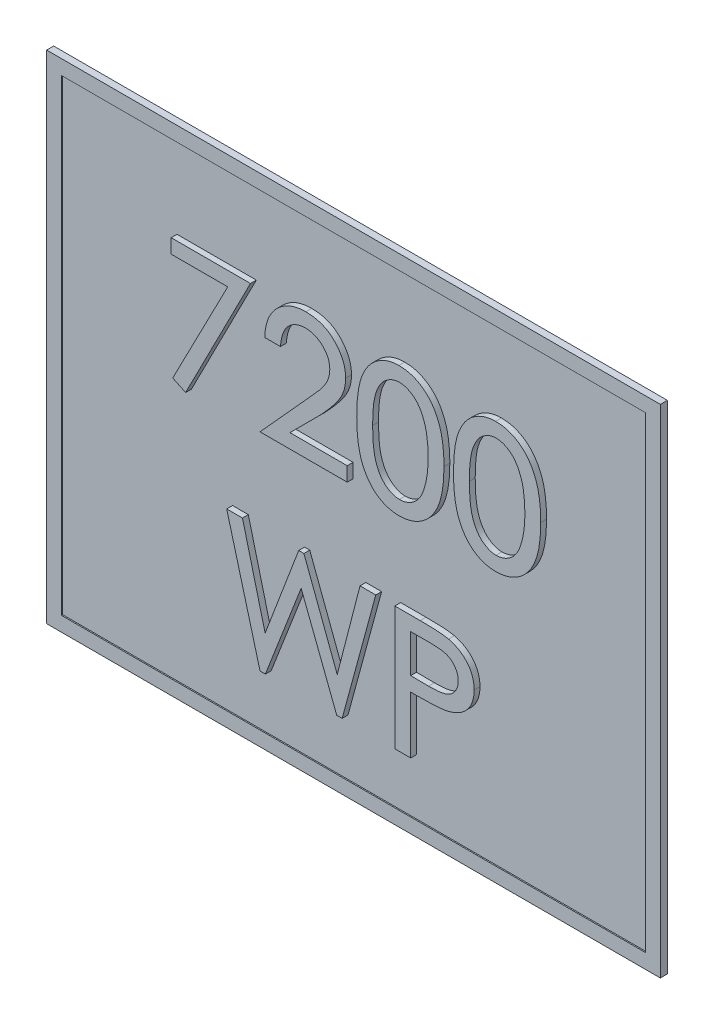
from build123d import *

# Parameters (mm, degrees)
SKETCH1_W           = 1000
SKETCH1_H           = 800
BOSS_EXTRUDE1_DEPTH = 10
BOSS_EXTRUDE2_DEPTH = 10
SKETCH3_W           = 1050
SKETCH3_H           = 850
SKETCH3_W_2         = 1000
SKETCH3_H_2         = 800
BOSS_EXTRUDE3_DEPTH = 12


with BuildPart() as part:
    # Sketch1 → Boss-Extrude1 (new body)
    with BuildSketch(Plane.XY):
        Rectangle(SKETCH1_W, SKETCH1_H)
    extrude(amount=BOSS_EXTRUDE1_DEPTH)

    # Sketch2 → Boss-Extrude2 (add)
    # profile 1 of 6: a face of its own
    with BuildSketch(Plane.XY.offset(10)):
        Polygon((-303.931623932, 261.496484556), (-168.247863248, 261.496484556), (-279.254139957, 44.402467462), (-301.302751068, 54.96036009), (-207.087339744, 237.073407633), (-303.931623932, 237.073407633), align=None)
    # profile 2 of 6: a face of its own
    with BuildSketch(Plane.XY.offset(10)):
        with BuildLine():
            Line((-116.984842415, 193.654604214), (-143.824786325, 193.654604214))
            add(Edge.make_bspline(
                [(-143.824786325, 193.654604214), (-143.69871103, 196.385712837), (-143.452125051, 201.727386582), (-142.357156167, 209.510802037), (-140.583384584, 216.844764853), (-138.344510397, 223.791447472), (-135.357914636, 230.264012655), (-131.91198054, 236.375293816), (-127.751946342, 241.997210511), (-123.050880422, 247.138656125), (-117.947707341, 251.809859568), (-112.461772398, 255.837749582), (-106.685804753, 259.270106613), (-100.618668625, 262.070932688), (-94.248482182, 264.239558842), (-87.593402868, 265.817613737), (-80.632200231, 266.76677627), (-75.886924768, 266.870998149), (-73.481236645, 266.923834983)],
                knots=[0, 0, 0, 0, 1.154964179, 2.258951466, 3.315045469, 4.34063582, 5.337653555, 6.322213479, 7.300594401, 8.285733883, 9.262436119, 10.219305053, 11.156568068, 12.097250375, 13.037875795, 13.995471444, 14.983774372, 16, 16, 16, 16], degree=3))
            add(Edge.make_bspline(
                [(-73.481236645, 266.923834983), (-70.962476003, 266.87231205), (-66.01997112, 266.771209807), (-58.822493601, 265.819825376), (-52.010739956, 264.285718668), (-45.582715712, 262.190680426), (-39.550132257, 259.393258731), (-33.90109372, 256.019876672), (-28.689901424, 251.965193259), (-23.878732846, 247.428255696), (-19.629226917, 242.43758701), (-15.791050294, 237.306586767), (-12.618425715, 231.931192437), (-9.960566041, 226.40955992), (-7.915301128, 220.696370897), (-6.470941449, 214.814875518), (-5.605168115, 208.761077237), (-5.486999268, 204.667561955), (-5.427350427, 202.601252184)],
                knots=[0, 0, 0, 0, 1.156722346, 2.269809107, 3.328396062, 4.361258308, 5.3694338, 6.377253737, 7.377324894, 8.397019439, 9.4098266, 10.385180797, 11.337325354, 12.27255833, 13.196816462, 14.119704983, 15.050871513, 16, 16, 16, 16], degree=3))
            add(Edge.make_bspline(
                [(-5.427350427, 202.601252184), (-5.535893279, 199.710823899), (-5.751492034, 193.969563868), (-7.411669208, 185.475699152), (-10.202621549, 177.255411689), (-13.426438497, 170.561941742), (-16.686940423, 165.151514586), (-19.679080716, 160.685692863), (-23.194071417, 155.856783925), (-27.307293295, 150.697112818), (-31.855187923, 145.088624288), (-37.018415546, 139.175999926), (-42.637166452, 132.839534507), (-46.644372193, 128.572851663), (-48.718950321, 126.36393915)],
                knots=[0, 0, 0, 0, 1.155755081, 2.295677249, 3.447123235, 4.6205014, 5.259503175, 5.973005395, 6.77029923, 7.648035671, 8.612336498, 9.658570495, 10.787814065, 12, 12, 12, 12], degree=3))
            Line((-48.718950321, 126.36393915), (-100.787593483, 74.252894812))
            Line((-100.787593483, 74.252894812), (-2.713675214, 74.252894812))
            Line((-2.713675214, 74.252894812), (-2.713675214, 49.829817889))
            Line((-2.713675214, 49.829817889), (-151.965811966, 49.829817889))
            Line((-151.965811966, 49.829817889), (-70.979567308, 139.253896415))
            add(Edge.make_bspline(
                [(-70.979567308, 139.253896415), (-69.050582316, 141.3111373), (-65.348824859, 145.259020161), (-60.131721813, 151.038086735), (-55.424726897, 156.380743605), (-51.202745329, 161.283133912), (-47.576333579, 165.811150982), (-44.447933934, 169.8981798), (-41.852960487, 173.56352009), (-39.1580682, 177.877930718), (-36.48770637, 183.049735857), (-34.216077865, 189.35861192), (-32.852989485, 195.8013429), (-32.660445325, 200.135682871), (-32.564102564, 202.304443958)],
                knots=[0, 0, 0, 0, 1.341560447, 2.574479018, 3.703506985, 4.728875774, 5.651874962, 6.462761537, 7.177175968, 7.787249671, 8.88179658, 9.938774664, 10.968630673, 12, 12, 12, 12], degree=3))
            add(Edge.make_bspline(
                [(-32.564102564, 202.304443958), (-32.587845467, 203.64986122), (-32.634825609, 206.312041762), (-33.275322502, 210.210485923), (-34.177577399, 213.99175983), (-35.573050162, 217.595071987), (-37.254338083, 221.091313674), (-39.357330145, 224.435288304), (-41.88264967, 227.595976904), (-44.691829996, 230.644492986), (-47.798857269, 233.396957731), (-51.080620577, 235.865516011), (-54.577477687, 237.870306464), (-58.193819275, 239.623530807), (-62.042061461, 240.866452169), (-66.027609869, 241.791871016), (-70.181759026, 242.432927327), (-73.012353713, 242.477843018), (-74.456463675, 242.50075806)],
                knots=[0, 0, 0, 0, 0.999432927, 1.977580462, 2.931018689, 3.885672852, 4.844657058, 5.812871023, 6.815890212, 7.849665183, 8.891901864, 9.898878619, 10.897592748, 11.885014695, 12.882178885, 13.896915602, 14.927050508, 16, 16, 16, 16], degree=3))
            add(Edge.make_bspline(
                [(-74.456463675, 242.50075806), (-75.829371732, 242.472599453), (-78.53024232, 242.41720408), (-82.507942794, 241.845652096), (-86.326042774, 240.91505308), (-89.997422385, 239.624227355), (-93.548672785, 238.031722057), (-96.892959958, 235.968634539), (-100.084945243, 233.568628087), (-103.166827456, 230.874982125), (-105.971695686, 227.714799122), (-108.480442004, 224.125527955), (-110.695764007, 220.10325767), (-112.589320132, 215.655024731), (-114.158602617, 210.769159163), (-115.417475405, 205.45160196), (-116.390705744, 199.700038973), (-116.783133173, 195.707027702), (-116.984842415, 193.654604214)],
                knots=[0, 0, 0, 0, 0.911540883, 1.79324023, 2.663162255, 3.518366492, 4.375475705, 5.243419306, 6.122264358, 7.02676621, 7.957780629, 8.921596253, 9.930241338, 11.002848587, 12.128200329, 13.335197372, 14.630280975, 16, 16, 16, 16], degree=3))
        make_face()
    # profile 3 of 6: a face of its own
    with BuildSketch(Plane.XY.offset(10)):
        with BuildLine():
            add(Edge.make_bspline(
                [(13.568376068, 155.578348872), (13.588578605, 158.942591834), (13.627812719, 165.476083016), (14.050577604, 174.980639261), (14.779878317, 183.902092259), (15.716639439, 192.240706728), (17.0126236, 200.002211781), (18.495497931, 207.190442862), (20.32087083, 213.806284332), (22.452968918, 219.861541487), (24.846886288, 225.463757733), (27.47900981, 230.683106098), (30.332668974, 235.58585299), (33.388590379, 240.170290826), (36.791248843, 244.334284774), (40.340885155, 248.220439621), (44.170779868, 251.752894548), (48.245835372, 254.913964635), (52.461261134, 257.771874266), (56.866901521, 260.180710999), (61.360676007, 262.279037319), (65.999890254, 263.976401198), (70.75090787, 265.294929343), (75.630743778, 266.215730994), (80.616193815, 266.849834295), (83.994740319, 266.899082943), (85.692775107, 266.923834983)],
                knots=[0, 0, 0, 0, 1.622528522, 3.151013738, 4.587225782, 5.939257941, 7.196658267, 8.381214254, 9.47772444, 10.503964975, 11.475138444, 12.414102326, 13.321377868, 14.209997518, 15.068075989, 15.912287155, 16.746865696, 17.577313739, 18.397854368, 19.200328723, 19.996378645, 20.787862277, 21.580050128, 22.371504404, 23.181529048, 24, 24, 24, 24], degree=3))
            add(Edge.make_bspline(
                [(85.692775107, 266.923834983), (87.545145614, 266.875054729), (91.201395984, 266.778771171), (96.627447886, 266.254790242), (101.871576886, 265.196174415), (107.005734971, 263.868628948), (111.946761565, 262.053845556), (116.792532262, 259.966927863), (121.393896995, 257.323651243), (125.907799039, 254.432265683), (130.179469976, 251.097927129), (134.265153748, 247.474934856), (138.037467999, 243.439617655), (141.633920463, 239.130829817), (144.870033826, 234.379821661), (147.950719797, 229.352953034), (150.678470572, 223.92503119), (153.266510862, 218.192075908), (155.491085392, 212.001647976), (157.504538098, 205.389099173), (159.136221234, 198.27204493), (160.489757213, 190.672603512), (161.532848773, 182.577980618), (162.303198563, 174.007404133), (162.705395278, 164.952861306), (162.781457617, 158.758780655), (162.820512821, 155.578348872)],
                knots=[0, 0, 0, 0, 0.875057392, 1.727207867, 2.570264412, 3.399251263, 4.229017074, 5.053828049, 5.887584622, 6.731829445, 7.583639997, 8.443960147, 9.308026848, 10.190032267, 11.091770676, 12.020167189, 12.972467704, 13.958579741, 14.989078804, 16.076606933, 17.221320015, 18.435081626, 19.720875061, 21.074561036, 22.497895074, 24, 24, 24, 24], degree=3))
            add(Edge.make_bspline(
                [(162.820512821, 155.578348872), (162.781048237, 152.412099725), (162.704197677, 146.246368234), (162.30777312, 137.233482452), (161.517456897, 128.709518204), (160.5443715, 120.650550934), (159.179463101, 113.081056179), (157.517530531, 105.997035048), (155.653807546, 99.361241773), (153.37549645, 93.231833512), (150.852745773, 87.505648707), (148.115731433, 82.126261808), (145.101349079, 77.083071995), (141.763656621, 72.430797205), (138.261697358, 68.023049231), (134.443333549, 64.013021648), (130.378153478, 60.324280724), (126.075989407, 57.00380395), (121.586083938, 54.009400845), (116.880270979, 51.481762789), (112.077173249, 49.238232319), (107.069550296, 47.537967853), (101.958911686, 46.086931625), (96.659201889, 45.149639676), (91.219617704, 44.529072429), (87.546045154, 44.44492085), (85.692775107, 44.402467462)],
                knots=[0, 0, 0, 0, 1.496607488, 2.914388442, 4.262485651, 5.541812885, 6.749953981, 7.895567619, 8.980172623, 10.005210728, 10.983286874, 11.936336572, 12.856292636, 13.757107149, 14.640766483, 15.514956722, 16.370989637, 17.232841377, 18.081413197, 18.918442167, 19.755471137, 20.583656588, 21.41504191, 22.264086897, 23.124254193, 24, 24, 24, 24], degree=3))
            add(Edge.make_bspline(
                [(85.692775107, 44.402467462), (83.981129469, 44.431551653), (80.591093227, 44.489154968), (75.5851607, 45.054108234), (70.708664112, 45.991733162), (65.975925932, 47.305854474), (61.353693154, 48.97428361), (56.862010702, 50.995352263), (52.530401154, 53.442619263), (48.317526824, 56.192329599), (44.284573044, 59.319922871), (40.528154821, 62.854886133), (36.957955579, 66.712738833), (33.644703445, 70.935082931), (30.515180117, 75.494661436), (27.6939614, 80.434431482), (25.063670117, 85.701634628), (22.625059792, 91.336841113), (20.423224577, 97.437959717), (18.667062681, 104.124353491), (17.011019093, 111.323061296), (15.795721498, 119.106907675), (14.741293759, 127.417169806), (14.12955994, 136.307794463), (13.606786303, 145.74929555), (13.58141422, 152.241928525), (13.568376068, 155.578348872)],
                knots=[0, 0, 0, 0, 0.82614074, 1.636230647, 2.42850654, 3.22151677, 4.005075515, 4.799112676, 5.596456327, 6.404618302, 7.226350817, 8.05679228, 8.892237205, 9.761873943, 10.645770802, 11.559890835, 12.505927976, 13.487073095, 14.523090282, 15.633895838, 16.822583925, 18.088023083, 19.435493537, 20.865857947, 22.389433785, 24, 24, 24, 24], degree=3))
        make_face()
        with BuildLine():
            add(Edge.make_bspline(
                [(40.705128205, 155.663151223), (40.716027901, 152.821938586), (40.737128897, 147.321563496), (41.050445319, 139.362279326), (41.496523321, 131.950942781), (42.163784141, 125.089563202), (43.053554707, 118.76793815), (44.106686326, 112.99479774), (45.307414451, 107.75908163), (46.771303713, 103.052186366), (48.392209213, 98.763470952), (50.194447535, 94.815168924), (52.065773549, 91.11783072), (54.173765226, 87.744740226), (56.406180525, 84.649801827), (58.803330423, 81.844796252), (61.279640224, 79.268238953), (64.8121425, 76.407215203), (69.3383367, 73.416017897), (74.957068202, 70.822225561), (80.618138588, 69.110066567), (84.437443776, 68.91977715), (86.328792735, 68.825544385)],
                knots=[0, 0, 0, 0, 1.564601651, 3.028951736, 4.386019676, 5.653114642, 6.824348509, 7.900668805, 8.88431448, 9.780488761, 10.613163047, 11.407444027, 12.169849642, 12.89344098, 13.595615509, 14.26934431, 14.924332585, 15.560171042, 16.769153194, 17.901006317, 18.960562374, 20, 20, 20, 20], degree=3))
            add(Edge.make_bspline(
                [(86.328792735, 68.825544385), (88.472071842, 68.937688184), (92.745292199, 69.161277898), (99.038717872, 70.789293728), (105.073076929, 73.521688947), (109.854427408, 76.608677889), (113.466930769, 79.611151506), (116.075812989, 82.167155667), (118.480450793, 85.020757991), (120.750507332, 88.128504998), (122.803095005, 91.541235088), (124.782261869, 95.181492053), (126.505503332, 99.136611405), (127.50144541, 101.892716771), (128.00914797, 103.297699834)],
                knots=[0, 0, 0, 0, 1.331887272, 2.655486065, 4.012646414, 5.436183829, 6.178803566, 6.930724497, 7.703763371, 8.496530827, 9.320959298, 10.178042319, 11.071218497, 12, 12, 12, 12], degree=3))
            add(Edge.make_bspline(
                [(128.00914797, 103.297699834), (128.620812441, 105.143648146), (129.867732842, 108.906741675), (131.429952711, 114.765628841), (132.723278443, 120.91336248), (133.836903979, 127.317202494), (134.682481502, 134.009411161), (135.266953208, 140.983542476), (135.602214601, 148.239639294), (135.656276509, 153.161141388), (135.683760684, 155.663151223)],
                knots=[0, 0, 0, 0, 0.877617242, 1.789083553, 2.735016418, 3.71249782, 4.722174671, 5.778575778, 6.870664861, 8, 8, 8, 8], degree=3))
            add(Edge.make_bspline(
                [(135.683760684, 155.663151223), (135.677182554, 158.165417263), (135.664354098, 163.045254956), (135.283078861, 170.183263604), (134.82196706, 176.97769527), (134.026463857, 183.406236629), (133.136171089, 189.500969312), (131.915002117, 195.21880361), (130.605228301, 200.616821016), (128.968939314, 205.628350937), (127.17998731, 210.303944573), (125.293156761, 214.659165148), (123.253025063, 218.697497556), (121.00528215, 222.368271117), (118.632879734, 225.73203785), (116.126966639, 228.768567755), (113.450202745, 231.460768993), (109.707995786, 234.496283374), (104.883821288, 237.655595444), (98.851593958, 240.490911564), (92.622715454, 242.162415751), (88.415816536, 242.388565953), (86.328792735, 242.50075806)],
                knots=[0, 0, 0, 0, 1.353201578, 2.638969622, 3.865559904, 5.035676431, 6.141732754, 7.195734042, 8.19695873, 9.144657206, 10.044788335, 10.904062871, 11.710933862, 12.489720227, 13.229995877, 13.935715626, 14.616825307, 15.279494989, 16.538995736, 17.725922936, 18.871840505, 20, 20, 20, 20], degree=3))
            add(Edge.make_bspline(
                [(86.328792735, 242.50075806), (84.437989161, 242.404684085), (80.606155503, 242.209984066), (74.936493691, 240.521604054), (69.337988972, 237.907245525), (64.842124893, 234.913977809), (61.338836713, 232.05598826), (58.828719764, 229.538034583), (56.509687308, 226.717179022), (54.271740611, 223.647152797), (52.228246382, 220.2518764), (50.243472676, 216.593286416), (48.49474875, 212.610936463), (46.850175178, 208.318935393), (45.401704781, 203.60343777), (44.149079837, 198.375712525), (43.029708001, 192.608955293), (42.222980453, 186.274572316), (41.544817786, 179.402768935), (41.0372861, 171.979816962), (40.74094933, 164.004524856), (40.717329172, 158.504290937), (40.705128205, 155.663151223)],
                knots=[0, 0, 0, 0, 1.039778295, 2.107176824, 3.232337611, 4.43520669, 5.071253539, 5.720927637, 6.389866065, 7.081397607, 7.811854436, 8.571243718, 9.372887587, 10.205834777, 11.102302774, 12.088086757, 13.166194718, 14.33675119, 15.604261439, 16.970055543, 18.43488556, 20, 20, 20, 20], degree=3))
        make_face(mode=Mode.SUBTRACT)
    # profile 4 of 6: a face of its own
    with BuildSketch(Plane.XY.offset(10)):
        with BuildLine():
            add(Edge.make_bspline(
                [(179.102564103, 155.578348872), (179.122766639, 158.942591834), (179.162000753, 165.476083016), (179.584765638, 174.980639261), (180.314066352, 183.902092259), (181.250827473, 192.240706728), (182.546811634, 200.002211781), (184.029685965, 207.190442862), (185.855058864, 213.806284332), (187.987156952, 219.861541487), (190.381074322, 225.463757733), (193.013197844, 230.683106098), (195.866857008, 235.58585299), (198.922778414, 240.170290826), (202.325436878, 244.334284774), (205.875073189, 248.220439621), (209.704967902, 251.752894548), (213.780023406, 254.913964635), (217.995449169, 257.771874266), (222.401089556, 260.180710999), (226.894864041, 262.279037319), (231.534078288, 263.976401198), (236.285095905, 265.294929343), (241.164931812, 266.215730994), (246.150381849, 266.849834295), (249.528928354, 266.899082943), (251.226963141, 266.923834983)],
                knots=[0, 0, 0, 0, 1.622528522, 3.151013738, 4.587225782, 5.939257941, 7.196658267, 8.381214254, 9.47772444, 10.503964975, 11.475138444, 12.414102326, 13.321377868, 14.209997518, 15.068075989, 15.912287155, 16.746865696, 17.577313739, 18.397854368, 19.200328723, 19.996378645, 20.787862277, 21.580050128, 22.371504404, 23.181529048, 24, 24, 24, 24], degree=3))
            add(Edge.make_bspline(
                [(251.226963141, 266.923834983), (253.079333648, 266.875054729), (256.735584018, 266.778771171), (262.16163592, 266.254790242), (267.40576492, 265.196174415), (272.539923005, 263.868628948), (277.4809496, 262.053845556), (282.326720296, 259.966927863), (286.928085029, 257.323651243), (291.441987073, 254.432265683), (295.71365801, 251.097927129), (299.799341783, 247.474934856), (303.571656033, 243.439617655), (307.168108498, 239.130829817), (310.40422186, 234.379821661), (313.484907831, 229.352953034), (316.212658606, 223.92503119), (318.800698896, 218.192075908), (321.025273426, 212.001647976), (323.038726132, 205.389099173), (324.670409268, 198.27204493), (326.023945247, 190.672603512), (327.067036808, 182.577980618), (327.837386598, 174.007404133), (328.239583312, 164.952861306), (328.315645651, 158.758780655), (328.354700855, 155.578348872)],
                knots=[0, 0, 0, 0, 0.875057392, 1.727207867, 2.570264412, 3.399251263, 4.229017074, 5.053828049, 5.887584622, 6.731829445, 7.583639997, 8.443960147, 9.308026848, 10.190032267, 11.091770676, 12.020167189, 12.972467704, 13.958579741, 14.989078804, 16.076606933, 17.221320015, 18.435081626, 19.720875061, 21.074561036, 22.497895074, 24, 24, 24, 24], degree=3))
            add(Edge.make_bspline(
                [(328.354700855, 155.578348872), (328.315236272, 152.412099725), (328.238385711, 146.246368234), (327.841961154, 137.233482452), (327.051644931, 128.709518204), (326.078559535, 120.650550934), (324.713651135, 113.081056179), (323.051718565, 105.997035048), (321.18799558, 99.361241773), (318.909684484, 93.231833512), (316.386933807, 87.505648707), (313.649919467, 82.126261808), (310.635537113, 77.083071995), (307.297844655, 72.430797205), (303.795885392, 68.023049231), (299.977521583, 64.013021648), (295.912341512, 60.324280724), (291.610177441, 57.00380395), (287.120271973, 54.009400845), (282.414459013, 51.481762789), (277.611361283, 49.238232319), (272.60373833, 47.537967853), (267.49309972, 46.086931625), (262.193389923, 45.149639676), (256.753805738, 44.529072429), (253.080233188, 44.44492085), (251.226963141, 44.402467462)],
                knots=[0, 0, 0, 0, 1.496607488, 2.914388442, 4.262485651, 5.541812885, 6.749953981, 7.895567619, 8.980172623, 10.005210728, 10.983286874, 11.936336572, 12.856292636, 13.757107149, 14.640766483, 15.514956722, 16.370989637, 17.232841377, 18.081413197, 18.918442167, 19.755471137, 20.583656588, 21.41504191, 22.264086897, 23.124254193, 24, 24, 24, 24], degree=3))
            add(Edge.make_bspline(
                [(251.226963141, 44.402467462), (249.515317503, 44.431551653), (246.125281261, 44.489154968), (241.119348734, 45.054108234), (236.242852147, 45.991733162), (231.510113966, 47.305854474), (226.887881188, 48.97428361), (222.396198736, 50.995352263), (218.064589188, 53.442619263), (213.851714858, 56.192329599), (209.818761078, 59.319922871), (206.062342855, 62.854886133), (202.492143613, 66.712738833), (199.178891479, 70.935082931), (196.049368151, 75.494661436), (193.228149435, 80.434431482), (190.597858151, 85.701634628), (188.159247826, 91.336841113), (185.957412612, 97.437959717), (184.201250716, 104.124353491), (182.545207127, 111.323061296), (181.329909532, 119.106907675), (180.275481794, 127.417169806), (179.663747975, 136.307794463), (179.140974337, 145.74929555), (179.115602254, 152.241928525), (179.102564103, 155.578348872)],
                knots=[0, 0, 0, 0, 0.82614074, 1.636230647, 2.42850654, 3.22151677, 4.005075515, 4.799112676, 5.596456327, 6.404618302, 7.226350817, 8.05679228, 8.892237205, 9.761873943, 10.645770802, 11.559890835, 12.505927976, 13.487073095, 14.523090282, 15.633895838, 16.822583925, 18.088023083, 19.435493537, 20.865857947, 22.389433785, 24, 24, 24, 24], degree=3))
        make_face()
        with BuildLine():
            add(Edge.make_bspline(
                [(206.239316239, 155.663151223), (206.250215935, 152.821938586), (206.271316931, 147.321563496), (206.584633353, 139.362279326), (207.030711355, 131.950942781), (207.697972176, 125.089563202), (208.587742742, 118.76793815), (209.64087436, 112.99479774), (210.841602485, 107.75908163), (212.305491748, 103.052186366), (213.926397247, 98.763470952), (215.728635569, 94.815168924), (217.599961583, 91.11783072), (219.70795326, 87.744740226), (221.940368559, 84.649801827), (224.337518457, 81.844796252), (226.813828258, 79.268238953), (230.346330534, 76.407215203), (234.872524734, 73.416017897), (240.491256236, 70.822225561), (246.152326622, 69.110066567), (249.97163181, 68.91977715), (251.862980769, 68.825544385)],
                knots=[0, 0, 0, 0, 1.564601651, 3.028951736, 4.386019676, 5.653114642, 6.824348509, 7.900668805, 8.88431448, 9.780488761, 10.613163047, 11.407444027, 12.169849642, 12.89344098, 13.595615509, 14.26934431, 14.924332585, 15.560171042, 16.769153194, 17.901006317, 18.960562374, 20, 20, 20, 20], degree=3))
            add(Edge.make_bspline(
                [(251.862980769, 68.825544385), (254.006259876, 68.937688184), (258.279480233, 69.161277898), (264.572905906, 70.789293728), (270.607264963, 73.521688947), (275.388615442, 76.608677889), (279.001118803, 79.611151506), (281.610001023, 82.167155667), (284.014638828, 85.020757991), (286.284695366, 88.128504998), (288.337283039, 91.541235088), (290.316449903, 95.181492053), (292.039691366, 99.136611405), (293.035633444, 101.892716771), (293.543336004, 103.297699834)],
                knots=[0, 0, 0, 0, 1.331887272, 2.655486065, 4.012646414, 5.436183829, 6.178803566, 6.930724497, 7.703763371, 8.496530827, 9.320959298, 10.178042319, 11.071218497, 12, 12, 12, 12], degree=3))
            add(Edge.make_bspline(
                [(293.543336004, 103.297699834), (294.155000475, 105.143648146), (295.401920877, 108.906741675), (296.964140745, 114.765628841), (298.257466477, 120.91336248), (299.371092013, 127.317202494), (300.216669536, 134.009411161), (300.801141243, 140.983542476), (301.136402635, 148.239639294), (301.190464543, 153.161141388), (301.217948718, 155.663151223)],
                knots=[0, 0, 0, 0, 0.877617242, 1.789083553, 2.735016418, 3.71249782, 4.722174671, 5.778575778, 6.870664861, 8, 8, 8, 8], degree=3))
            add(Edge.make_bspline(
                [(301.217948718, 155.663151223), (301.211370588, 158.165417263), (301.198542133, 163.045254956), (300.817266895, 170.183263604), (300.356155095, 176.97769527), (299.560651892, 183.406236629), (298.670359123, 189.500969312), (297.449190151, 195.21880361), (296.139416335, 200.616821016), (294.503127348, 205.628350937), (292.714175344, 210.303944573), (290.827344796, 214.659165148), (288.787213098, 218.697497556), (286.539470184, 222.368271117), (284.167067769, 225.73203785), (281.661154673, 228.768567755), (278.984390779, 231.460768993), (275.24218382, 234.496283374), (270.418009322, 237.655595444), (264.385781992, 240.490911564), (258.156903488, 242.162415751), (253.95000457, 242.388565953), (251.862980769, 242.50075806)],
                knots=[0, 0, 0, 0, 1.353201578, 2.638969622, 3.865559904, 5.035676431, 6.141732754, 7.195734042, 8.19695873, 9.144657206, 10.044788335, 10.904062871, 11.710933862, 12.489720227, 13.229995877, 13.935715626, 14.616825307, 15.279494989, 16.538995736, 17.725922936, 18.871840505, 20, 20, 20, 20], degree=3))
            add(Edge.make_bspline(
                [(251.862980769, 242.50075806), (249.972177195, 242.404684085), (246.140343537, 242.209984066), (240.470681725, 240.521604054), (234.872177007, 237.907245525), (230.376312928, 234.913977809), (226.873024747, 232.05598826), (224.362907798, 229.538034583), (222.043875342, 226.717179022), (219.805928646, 223.647152797), (217.762434417, 220.2518764), (215.77766071, 216.593286416), (214.028936785, 212.610936463), (212.384363212, 208.318935393), (210.935892815, 203.60343777), (209.683267871, 198.375712525), (208.563896036, 192.608955293), (207.757168487, 186.274572316), (207.079005821, 179.402768935), (206.571474135, 171.979816962), (206.275137364, 164.004524856), (206.251517206, 158.504290937), (206.239316239, 155.663151223)],
                knots=[0, 0, 0, 0, 1.039778295, 2.107176824, 3.232337611, 4.43520669, 5.071253539, 5.720927637, 6.389866065, 7.081397607, 7.811854436, 8.571243718, 9.372887587, 10.205834777, 11.102302774, 12.088086757, 13.166194718, 14.33675119, 15.604261439, 16.970055543, 18.43488556, 20, 20, 20, 20], degree=3))
        make_face(mode=Mode.SUBTRACT)
    # profile 5 of 6: a face of its own
    with BuildSketch(Plane.XY.offset(10)):
        Polygon((-208.952991453, -92.877179249), (-181.985844017, -92.877179249), (-143.188768697, -244.122171236), (-85.735176282, -92.877179249), (-76.873330662, -92.877179249), (-19.84375, -243.825363009), (19.165331197, -92.877179249), (46.132478632, -92.877179249), (-11.448317308, -304.543845915), (-20.691773504, -304.543845915), (-81.537459936, -146.72667177), (-142.764756944, -304.543845915), (-151.923410791, -304.543845915), align=None)
    # profile 6 of 6: a face of its own
    with BuildSketch(Plane.XY.offset(10)):
        with BuildLine():
            Line((78.696581197, -92.877179249), (122.07298344, -92.877179249))
            add(Edge.make_bspline(
                [(122.07298344, -92.877179249), (124.942296492, -92.878742398), (130.441211258, -92.881738105), (138.32724313, -93.084737284), (145.4816498, -93.259942394), (151.915002324, -93.596701593), (157.612653512, -94.057997146), (162.57664871, -94.600425448), (166.812317825, -95.210507449), (169.366758245, -95.762070222), (170.537526709, -96.014866214)],
                knots=[0, 0, 0, 0, 1.415450773, 2.712650385, 3.891531898, 4.945867971, 5.890285756, 6.71109784, 7.409261617, 8, 8, 8, 8], degree=3))
            add(Edge.make_bspline(
                [(170.537526709, -96.014866214), (172.185660851, -96.438693225), (175.436924319, -97.274774004), (180.08472642, -98.99818376), (184.494862751, -100.956483674), (188.652276298, -103.184116067), (192.514500747, -105.756912042), (196.164861626, -108.552214584), (199.491079329, -111.71140614), (202.60710734, -115.081227334), (205.341128268, -118.738647572), (207.790818914, -122.559910769), (209.821239882, -126.600519703), (211.489902385, -130.84544469), (212.794356203, -135.272553567), (213.732668661, -139.895951786), (214.296490482, -144.70550093), (214.352046112, -147.98303099), (214.38034188, -149.65235286)],
                knots=[0, 0, 0, 0, 1.085641105, 2.141637125, 3.15936318, 4.164535163, 5.147931294, 6.118832473, 7.09541784, 8.072503165, 9.045079613, 10.006206652, 10.966486436, 11.926469503, 12.914201526, 13.908586125, 14.934794539, 16, 16, 16, 16], degree=3))
            add(Edge.make_bspline(
                [(214.38034188, -149.65235286), (214.351425319, -151.32159695), (214.294407504, -154.613020479), (213.734146116, -159.451321781), (212.794983329, -164.084324526), (211.528816824, -168.532495862), (209.864793136, -172.768171885), (207.87642258, -176.827111646), (205.472863879, -180.663328309), (202.728918214, -184.303449318), (199.63022055, -187.691533795), (196.221679599, -190.81472195), (192.458491149, -193.618468526), (188.379251067, -196.153097885), (183.998173543, -198.463056109), (179.27118454, -200.449873709), (174.219373441, -202.142831535), (170.713302568, -203.043023599), (168.926282051, -203.501845381)],
                knots=[0, 0, 0, 0, 1.042501879, 2.055610221, 3.037454288, 3.993184118, 4.940927036, 5.876790881, 6.812738028, 7.76458517, 8.720845088, 9.677105007, 10.648370915, 11.647960469, 12.67482723, 13.739162042, 14.847666245, 16, 16, 16, 16], degree=3))
            add(Edge.make_bspline(
                [(168.926282051, -203.501845381), (167.614748095, -203.786195387), (164.753663853, -204.406499054), (160.005866667, -205.051969432), (154.473713772, -205.580776888), (148.139720431, -206.040849174), (141.029849621, -206.427314007), (133.112564948, -206.657367252), (124.405923446, -206.843003171), (118.32766807, -206.848615067), (115.16159188, -206.851538223)],
                knots=[0, 0, 0, 0, 0.596754895, 1.30180848, 2.129432098, 3.068723067, 4.126429569, 5.296393252, 6.591729958, 8, 8, 8, 8], degree=3))
            Line((115.16159188, -206.851538223), (105.833333333, -206.851538223))
            Line((105.833333333, -206.851538223), (105.833333333, -304.543845915))
            Line((105.833333333, -304.543845915), (78.696581197, -304.543845915))
            Line((78.696581197, -304.543845915), (78.696581197, -92.877179249))
        make_face()
        with BuildLine():
            Line((105.833333333, -117.300256172), (105.833333333, -182.51326365))
            Line((105.833333333, -182.51326365), (136.362179487, -182.852473052))
            add(Edge.make_bspline(
                [(136.362179487, -182.852473052), (138.086558413, -182.82973483), (141.408893617, -182.785925435), (146.203282952, -182.633814075), (150.613102923, -182.324658003), (154.646871846, -181.964095041), (158.312738437, -181.458584078), (161.594199253, -180.827681929), (164.519234345, -180.118829201), (167.864053622, -179.0043558), (171.608056311, -177.264193822), (175.588340156, -174.609066562), (179.096823136, -171.433730043), (181.994300962, -167.696365142), (184.326071119, -163.578524449), (186.059334738, -159.177312952), (187.040393129, -154.500882857), (187.175283706, -151.310369619), (187.243589744, -149.694754035)],
                knots=[0, 0, 0, 0, 1.196816259, 2.305888068, 3.328295896, 4.264290022, 5.116006351, 5.89509982, 6.582615619, 7.202969204, 8.339503699, 9.435837163, 10.511976311, 11.608836183, 12.702577786, 13.786378287, 14.879063815, 16, 16, 16, 16], degree=3))
            add(Edge.make_bspline(
                [(187.243589744, -149.694754035), (187.174790295, -148.135519294), (187.038329177, -145.042835814), (186.05214253, -140.494285395), (184.318078986, -136.179844498), (181.982510855, -132.119848499), (179.144356791, -128.408951292), (175.782428283, -125.216662149), (171.977655835, -122.607672681), (168.425608033, -120.936661025), (165.258410923, -119.849197569), (162.466982029, -119.210388693), (159.313520252, -118.613111266), (155.778443481, -118.101076495), (151.858462914, -117.731788589), (147.558303922, -117.49491039), (142.893555513, -117.309279171), (139.65555022, -117.303341013), (137.973424145, -117.300256172)],
                knots=[0, 0, 0, 0, 1.113934591, 2.209447376, 3.306634974, 4.424089692, 5.547326231, 6.633252657, 7.723023745, 8.829884498, 9.427152571, 10.113060991, 10.873719268, 11.720735618, 12.664423995, 13.686322671, 14.798057257, 16, 16, 16, 16], degree=3))
            Line((137.973424145, -117.300256172), (105.833333333, -117.300256172))
        make_face(mode=Mode.SUBTRACT)
    extrude(amount=BOSS_EXTRUDE2_DEPTH)

    # Sketch3 → Boss-Extrude3 (add)
    with BuildSketch(Plane.XY):
        Rectangle(SKETCH3_W, SKETCH3_H)
        Rectangle(SKETCH3_W_2, SKETCH3_H_2, mode=Mode.SUBTRACT)
    extrude(amount=BOSS_EXTRUDE3_DEPTH)


solid = part.part
